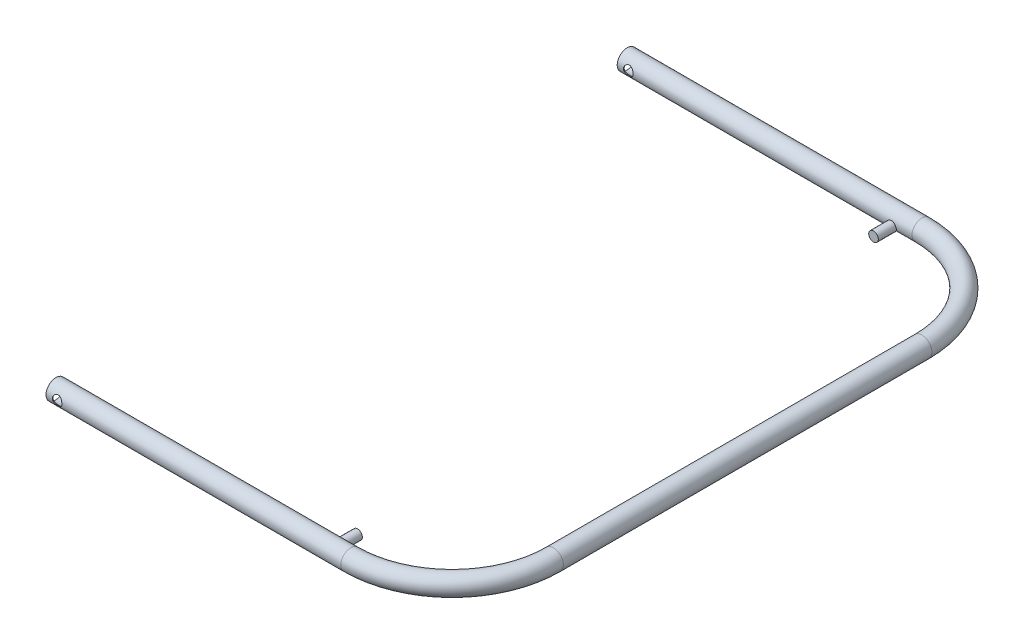
from build123d import *

# Parameters (mm, degrees)
SKETCH2_R                = 13.5
SKETCH2_R_2              = 12.5
SKETCH11_R               = 6.5
CUT_EXTRUDE1_DEPTH       = 516.5
BOSS_EXTRUDE1_REACH      = 933.549
BOSS_EXTRUDE1_END_RADIUS = 13.5
SKETCH12_R               = 6.5
BOSS_EXTRUDE2_REACH      = 933.549
BOSS_EXTRUDE2_END_RADIUS = 13.5
SKETCH13_R               = 6.5


with BuildPart() as part:
    # Sweep-Thin1: sweep along a path in Sketch1
    with BuildLine(Plane(origin=(0, 0, 0), x_dir=(1, 0, 0), z_dir=(0, 1, 0))) as sweep_thin1_path:
        Line((0, 400), (400, 400))
        ThreePointArc((400, 400), (506.066017178, 356.066017178), (550, 250))
        Line((550, 250), (550, -250))
        ThreePointArc((550, -250), (506.066017178, -356.066017178), (400, -400))
        Line((400, -400), (0, -400))
    # Sketch2 → Sweep-Thin1 (sweep)
    with BuildSketch(Plane(origin=(0, 0, -400), x_dir=(0, 0, -1), z_dir=(1, 0, 0))):
        with Locations((-12.5, 0)):
            Circle(SKETCH2_R)
        with Locations((-12.5, 0)):
            Circle(SKETCH2_R_2, mode=Mode.SUBTRACT)
    sweep(path=sweep_thin1_path.line)

    # Sketch11 → Cut-Extrude1 (cut, symmetric)
    with BuildSketch(Plane.XY):
        with Locations((15, 0)):
            Circle(SKETCH11_R)
    extrude(amount=CUT_EXTRUDE1_DEPTH, both=True, mode=Mode.SUBTRACT)

    # Boss-Extrude1: up to this cylinder (the profile starts outside it)
    boss_extrude1_end = Plane(origin=(371.755623, 0, -387.5), z_dir=(1, 0, 0)) * Cylinder(BOSS_EXTRUDE1_END_RADIUS, 1895.098, mode=Mode.PRIVATE)
    # Sketch12 → Boss-Extrude1 (add, up to the surface)
    with BuildSketch(Plane.XY.offset(-350), mode=Mode.PRIVATE) as boss_extrude1_sk1:
        with Locations((371.755622918, -3.61354097)):
            Circle(SKETCH12_R)
    boss_extrude1_tool1 = extrude(boss_extrude1_sk1.sketch, amount=-BOSS_EXTRUDE1_REACH, mode=Mode.PRIVATE) - boss_extrude1_end
    add(boss_extrude1_tool1.solids().sort_by_distance((371.755623, -3.613541, -350))[0])

    # Boss-Extrude2: up to this cylinder (the profile starts outside it)
    boss_extrude2_end = Plane(origin=(371.755623, 0, 387.5), z_dir=(-1, 0, 0)) * Cylinder(BOSS_EXTRUDE2_END_RADIUS, 1895.098, mode=Mode.PRIVATE)
    # Sketch13 → Boss-Extrude2 (add, up to the surface)
    with BuildSketch(Plane.XY.offset(350), mode=Mode.PRIVATE) as boss_extrude2_sk1:
        with Locations((371.755622918, -3.61354097)):
            Circle(SKETCH13_R)
    boss_extrude2_tool1 = extrude(boss_extrude2_sk1.sketch, amount=BOSS_EXTRUDE2_REACH, mode=Mode.PRIVATE) - boss_extrude2_end
    add(boss_extrude2_tool1.solids().sort_by_distance((371.755623, -3.613541, 350))[0])


solid = part.part
